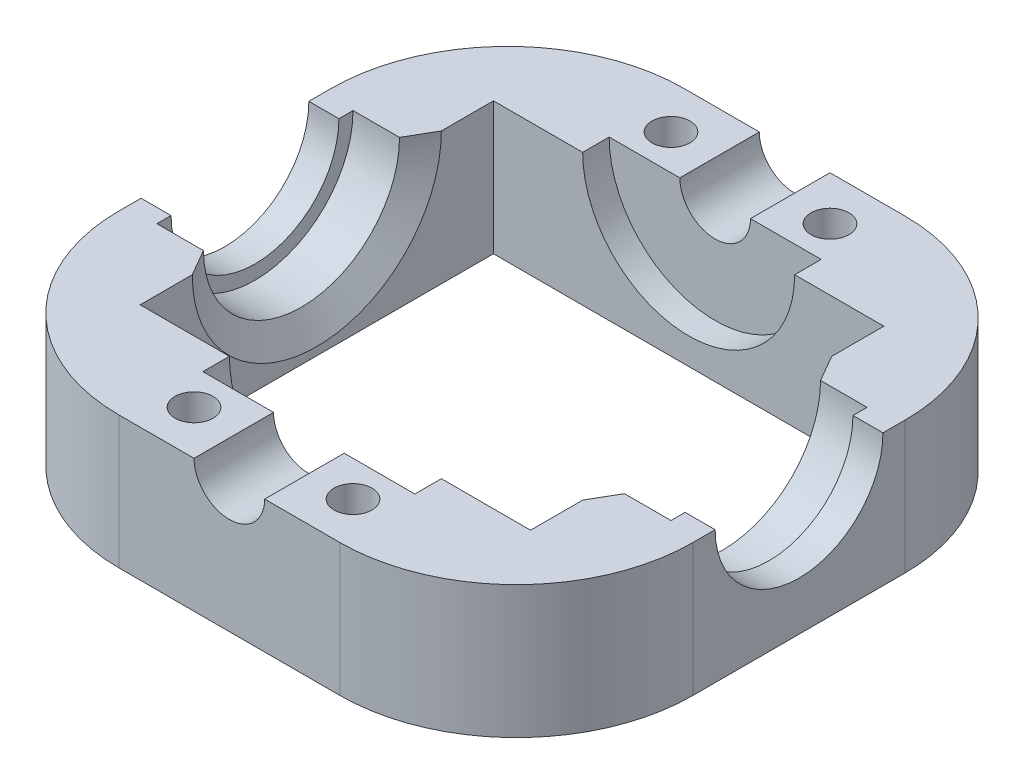
from build123d import *
from OCP.BRepFilletAPI import BRepFilletAPI_MakeChamfer

# Parameters (mm, degrees)
SKETCH1_W           = 65
SKETCH1_H           = 64
SKETCH1_W_2         = 44.2
SKETCH1_H_2         = 40
BOSS_EXTRUDE1_DEPTH = 15
SKETCH3_W           = 7
SKETCH3_H           = 11.1
SKETCH4_R           = 9.5
CUT_EXTRUDE2_DEPTH  = 74.986485252
SKETCH5_R           = 4
CUT_EXTRUDE3_DEPTH  = 74.32973476
SKETCH8_R           = 2.15
CUT_EXTRUDE6_DEPTH  = 49.013019068
FILLET1_R           = 20
CHAMFER1_SIZE       = 3
CHAMFER1_SIZE2      = 1.732050808
SKETCH9_W           = 12
SKETCH9_H           = 3


with BuildPart() as part:
    # Sketch1 → Boss-Extrude1 (new body)
    with BuildSketch(Plane(origin=(0, 0, 0), x_dir=(1, 0, 0), z_dir=(0, 1, 0))):
        Rectangle(SKETCH1_W, SKETCH1_H)
        Rectangle(SKETCH1_W_2, SKETCH1_H_2, mode=Mode.SUBTRACT)
    extrude(amount=BOSS_EXTRUDE1_DEPTH)

    # Sketch3 → Cut-Revolve1 (revolve, cut)
    with BuildSketch(Plane(origin=(0, 15, 0), x_dir=(1, 0, 0), z_dir=(0, 1, 0))):
        with Locations((25.6, -5.55)):
            Rectangle(SKETCH3_W, SKETCH3_H)
        with Locations((-25.6, -5.55)):
            Rectangle(SKETCH3_W, SKETCH3_H)
    revolve(axis=Axis((22.1, 15, 0), (1, 0, 0)), mode=Mode.SUBTRACT)

    # Sketch4 → Cut-Extrude2 (cut, through all)
    with BuildSketch(Plane(origin=(32.5, 0, 0), x_dir=(0, 0, -1), z_dir=(1, 0, 0))):
        with Locations((0, 15)):
            Circle(SKETCH4_R)
    extrude(amount=-CUT_EXTRUDE2_DEPTH, mode=Mode.SUBTRACT)

    # Sketch5 → Cut-Extrude3 (cut, through all)
    with BuildSketch(Plane.XY.offset(32)):
        with Locations((0, 15)):
            Circle(SKETCH5_R)
    extrude(amount=-CUT_EXTRUDE3_DEPTH, mode=Mode.SUBTRACT)

    # Sketch8 → Cut-Extrude6 (cut, through all)
    with BuildSketch(Plane(origin=(0, 15, 0), x_dir=(1, 0, 0), z_dir=(0, 1, 0))):
        with Locations((18, 16.5)):
            Circle(SKETCH8_R)
        with Locations((18, -16.5)):
            Circle(SKETCH8_R)
        with Locations((-18, -16.5)):
            Circle(SKETCH8_R)
        with Locations((-18, 16.5)):
            Circle(SKETCH8_R)
        with Locations(Location((9, -27, 0), (0, 0, 270))):
            Circle(SKETCH8_R)
        with Locations(Location((-9, -27, 0), (0, 0, 270))):
            Circle(SKETCH8_R)
        with Locations(Location((-9, 27, 0), (0, 0, 270))):
            Circle(SKETCH8_R)
        with Locations(Location((9, 27, 0), (0, 0, 270))):
            Circle(SKETCH8_R)
    extrude(amount=-CUT_EXTRUDE6_DEPTH, mode=Mode.SUBTRACT)

    # Fillet1
    fillet1_edges = [part.edges().sort_by_distance(p)[0] for p in [
        (-32.5, 7.5, -32),
        (32.5, 7.5, -32),
        (32.5, 7.5, 32),
        (-32.5, 7.5, 32),
    ]]
    fillet(fillet1_edges, radius=FILLET1_R)

    # Chamfer1: one chamfer whose edges measure the first distance from different faces: ONE call of the kernel's chamfer builder (chamfer() names one face for all edges)
    chamfer1_edges_1 = [part.edges().sort_by_distance(p)[0] for p in [
        (22.1, 3.9, 0),
    ]]
    chamfer1_side_1 = [part.faces().sort_by_distance(p)[0] for p in [
        (22.1, 0.427200187, 0),
    ]]
    chamfer1_edges_2 = [part.edges().sort_by_distance(p)[0] for p in [
        (-22.1, 3.9, 0),
    ]]
    chamfer1_side_2 = [part.faces().sort_by_distance(p)[0] for p in [
        (-22.1, 0.427200187, 0),
    ]]
    chamfer1 = BRepFilletAPI_MakeChamfer(part.part.solid().wrapped)
    for e in chamfer1_edges_1:
        chamfer1.Add(CHAMFER1_SIZE, CHAMFER1_SIZE2, e.wrapped, chamfer1_side_1[0].wrapped)  # the first distance lies on this face
    for e in chamfer1_edges_2:
        chamfer1.Add(CHAMFER1_SIZE, CHAMFER1_SIZE2, e.wrapped, chamfer1_side_2[0].wrapped)  # the first distance lies on this face
    add(Compound.cast(chamfer1.Shape()), mode=Mode.REPLACE)

    # Sketch9 → Cut-Revolve2 (revolve, cut)
    with BuildSketch(Plane(origin=(0, 15, 0), x_dir=(1, 0, 0), z_dir=(0, 1, 0))):
        with Locations((-6, -21.5)):
            Rectangle(SKETCH9_W, SKETCH9_H)
        with Locations((-6, 21.5)):
            Rectangle(SKETCH9_W, SKETCH9_H)
    revolve(axis=Axis((0, 15, -29.871415895), (0, 0, 1)), mode=Mode.SUBTRACT)


solid = part.part
